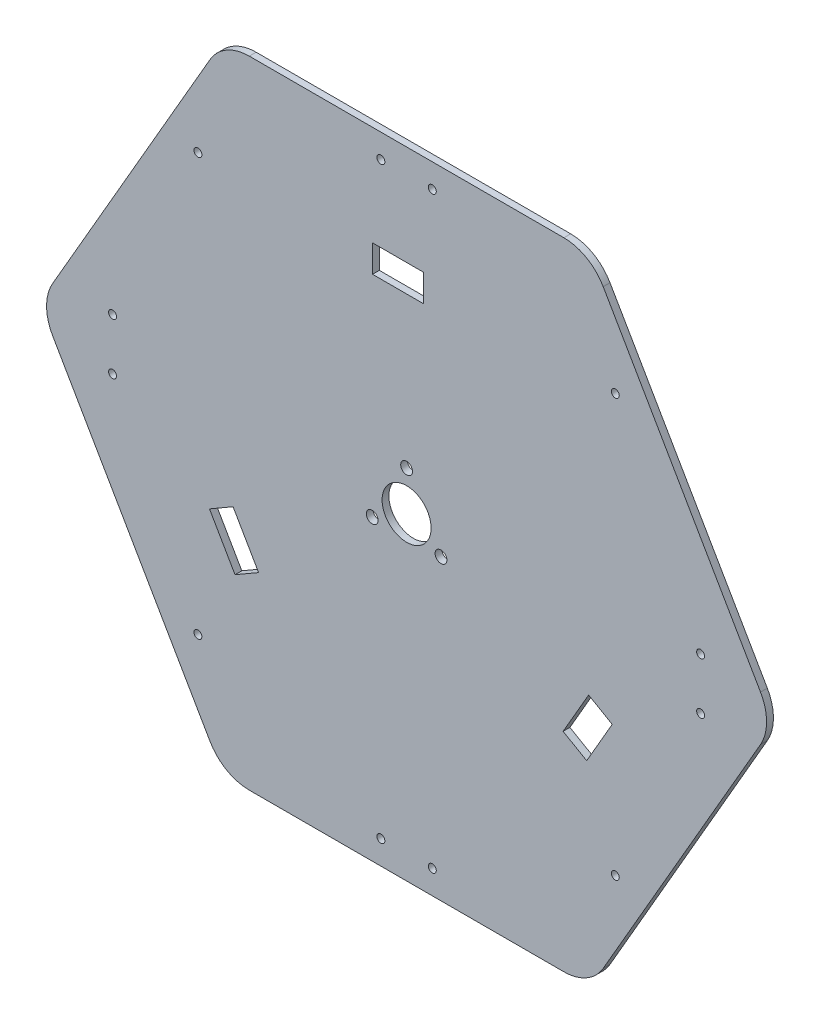
from build123d import *

# Parameters (mm, degrees)
CROQUIS1_R              = 10.8
CROQUIS1_R_2            = 2.6
CROQUIS1_W              = 22.5
CROQUIS1_H              = 12
SALIENTE_EXTRUIR1_DEPTH = 3
REDONDEO1_R             = 20
CROQUIS3_R              = 1.75
CORTAR_EXTRUIR1_DEPTH   = 212.545651301
MATRIZC1_COUNT          = 4


with BuildPart() as part:
    # Croquis1 → Saliente-Extruir1 (new body)
    with BuildSketch(Plane.XY):
        Polygon((-80.829037687, -140), (80.829037687, -140), (161.658075373, 0), (80.829037687, 140), (-80.829037687, 140), (-161.658075373, 0), align=None)
        Circle(CROQUIS1_R, mode=Mode.SUBTRACT)
        with Locations((0, 17.5)):
            Circle(CROQUIS1_R_2, mode=Mode.SUBTRACT)
        with Locations((15.155444566, -8.75)):
            Circle(CROQUIS1_R_2, mode=Mode.SUBTRACT)
        with Locations((-15.155444566, -8.75)):
            Circle(CROQUIS1_R_2, mode=Mode.SUBTRACT)
        with Locations((-3.75, 89.921841062)):
            Rectangle(CROQUIS1_W, CROQUIS1_H, mode=Mode.SUBTRACT)
        Polygon((90.570751138, -34.970539474), (80.178446292, -28.970539474), (68.928446292, -48.456111059), (79.320751138, -54.456111059), align=None, mode=Mode.SUBTRACT)
        Polygon((-75.570751138, -60.951301588), (-65.178446292, -54.951301588), (-76.428446292, -35.465730003), (-86.820751138, -41.465730003), align=None, mode=Mode.SUBTRACT)
    extrude(amount=SALIENTE_EXTRUIR1_DEPTH)

    # Redondeo1
    redondeo1_edges = [part.edges().sort_by_distance(p)[0] for p in [
        (161.658075373, 0, 1.5),
        (80.829037687, -140, 1.5),
        (-80.829037687, -140, 1.5),
        (-161.658075373, 0, 1.5),
        (-80.829037687, 140, 1.5),
        (80.829037687, 140, 1.5),
    ]]
    fillet(redondeo1_edges, radius=REDONDEO1_R)

    # Croquis3 → Cortar-Extruir1 (cut, through all)
    with BuildSketch(Plane(origin=(0, 0, 0), x_dir=(1, 0, 0), z_dir=(0, 0, -1))):
        with Locations(Location((129.505310752, 11.330246557, 0), (0, 0, 180))):
            Circle(CROQUIS3_R)
        with Locations(Location((91.923881554, 91.923881554, 0), (0, 0, 180))):
            Circle(CROQUIS3_R)
        with Locations(Location((11.330246557, 129.505310752, 0), (0, 0, 180))):
            Circle(CROQUIS3_R)
    cortar_extruir1 = extrude(amount=-CORTAR_EXTRUIR1_DEPTH, mode=Mode.SUBTRACT)

    # MatrizC1: Cortar-Extruir1 ×4 about axis
    matrizc1_axis = Axis((0, 0, 0), (0, 0, 1))
    for i in range(1, MATRIZC1_COUNT):
        add(cortar_extruir1.rotate(matrizc1_axis, i * 360 / MATRIZC1_COUNT), mode=Mode.SUBTRACT)


solid = part.part
